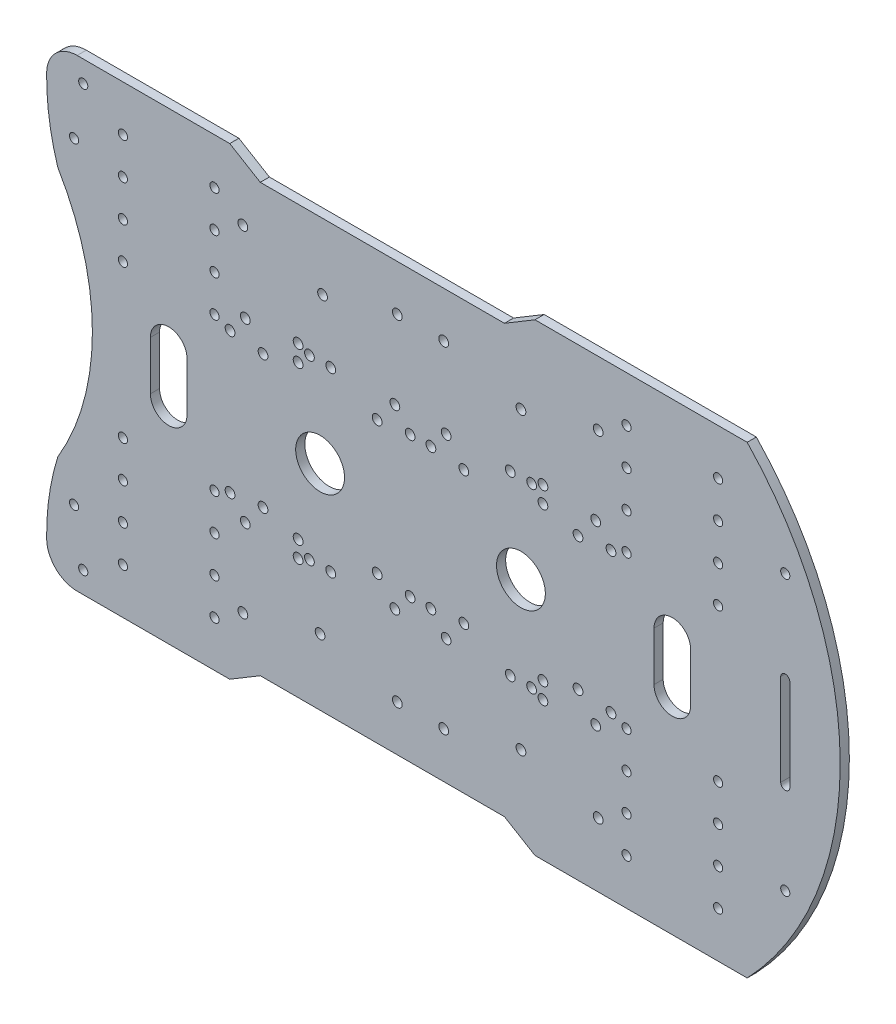
from build123d import *

# Parameters (mm, degrees)
SKETCH2_R           = 8
SKETCH2_R_2         = 1.6
SKETCH2_R_3         = 1.5
BOSS_EXTRUDE1_DEPTH = 3


with BuildPart() as part:
    # Sketch2 → Boss-Extrude1 (new body)
    with BuildSketch(Plane.XY):
        with BuildLine():
            Line((118.698481804, 213.752755906), (168.691338583, 213.752755906))
            Line((168.691338583, 213.752755906), (178.691338583, 219.752755906))
            Line((178.691338583, 219.752755906), (258.691338583, 219.752755906))
            Line((258.691338583, 219.752755906), (268.691338583, 213.752755906))
            Line((268.691338583, 213.752755906), (338.214919991, 213.752755906))
            ThreePointArc((338.214919991, 213.752755906), (368.691338583, 289.752755906), (338.214919991, 365.752755906))
            Line((338.214919991, 365.752755906), (268.691338583, 365.752755906))
            Line((268.691338583, 365.752755906), (258.691338583, 359.752755906))
            Line((258.691338583, 359.752755906), (178.691338583, 359.752755906))
            Line((178.691338583, 359.752755906), (168.691338583, 365.752755906))
            Line((168.691338583, 365.752755906), (118.698481804, 365.752755906))
            ThreePointArc((118.698481804, 365.752755906), (111.678103304, 362.874152237), (108.699502265, 355.895613048))
            ThreePointArc((108.699502265, 355.895613048), (109.530508537, 343.195810526), (112.36497097, 330.788499042))
            ThreePointArc((112.36497097, 330.788499042), (123.691338583, 289.752755906), (112.36497097, 248.717012769))
            ThreePointArc((112.36497097, 248.717012769), (109.530508537, 236.309701285), (108.699502265, 223.609898763))
            ThreePointArc((108.699502265, 223.609898763), (111.678103304, 216.631359574), (118.698481804, 213.752755906))
        make_face()
        with Locations((198.291338583, 289.752755906)):
            Circle(SKETCH2_R, mode=Mode.SUBTRACT)
        with Locations((264.091338583, 289.752755906)):
            Circle(SKETCH2_R, mode=Mode.SUBTRACT)
        with Locations((264.091338583, 338.052755906)):
            Circle(SKETCH2_R_2, mode=Mode.SUBTRACT)
        with Locations((260.591338583, 318.752755906)):
            Circle(SKETCH2_R_2, mode=Mode.SUBTRACT)
        with Locations((245.391338583, 311.552755906)):
            Circle(SKETCH2_R_2, mode=Mode.SUBTRACT)
        with Locations((238.791338583, 344.752755906)):
            Circle(SKETCH2_R_2, mode=Mode.SUBTRACT)
        with Locations((239.591338583, 318.752755906)):
            Circle(SKETCH2_R_2, mode=Mode.SUBTRACT)
        with Locations((234.591338583, 312.752755906)):
            Circle(SKETCH2_R_2, mode=Mode.SUBTRACT)
        with Locations((227.791338583, 312.752755906)):
            Circle(SKETCH2_R_2, mode=Mode.SUBTRACT)
        with Locations((216.991338583, 311.552755906)):
            Circle(SKETCH2_R_2, mode=Mode.SUBTRACT)
        with Locations((222.791338583, 318.752755906)):
            Circle(SKETCH2_R_2, mode=Mode.SUBTRACT)
        with Locations((223.591338583, 344.752755906)):
            Circle(SKETCH2_R_2, mode=Mode.SUBTRACT)
        with Locations((201.791338583, 318.752755906)):
            Circle(SKETCH2_R_2, mode=Mode.SUBTRACT)
        with Locations((194.791338583, 318.752755906)):
            Circle(SKETCH2_R_2, mode=Mode.SUBTRACT)
        with Locations((199.100829472, 338.052755906)):
            Circle(SKETCH2_R_2, mode=Mode.SUBTRACT)
        with Locations((191.091338583, 320.252755906)):
            Circle(SKETCH2_R_2, mode=Mode.SUBTRACT)
        with Locations((191.091338583, 314.852755906)):
            Circle(SKETCH2_R_2, mode=Mode.SUBTRACT)
        with Locations((179.591338583, 311.552755906)):
            Circle(SKETCH2_R_2, mode=Mode.SUBTRACT)
        with Locations((173.791338583, 318.752755906)):
            Circle(SKETCH2_R_2, mode=Mode.SUBTRACT)
        with Locations((168.791338583, 312.752755906)):
            Circle(SKETCH2_R_2, mode=Mode.SUBTRACT)
        with Locations((163.691338583, 314.752755906)):
            Circle(SKETCH2_R_3, mode=Mode.SUBTRACT)
        with Locations((163.691338583, 326.752755906)):
            Circle(SKETCH2_R_3, mode=Mode.SUBTRACT)
        with Locations((163.691338583, 338.752755906)):
            Circle(SKETCH2_R_3, mode=Mode.SUBTRACT)
        with Locations((172.991338583, 344.752755906)):
            Circle(SKETCH2_R_2, mode=Mode.SUBTRACT)
        with Locations((163.691338583, 350.752755906)):
            Circle(SKETCH2_R_3, mode=Mode.SUBTRACT)
        with Locations((133.691338583, 350.752755906)):
            Circle(SKETCH2_R_3, mode=Mode.SUBTRACT)
        with Locations((120.691338583, 358.752755906)):
            Circle(SKETCH2_R_3, mode=Mode.SUBTRACT)
        with Locations((117.691338583, 341.752755906)):
            Circle(SKETCH2_R_3, mode=Mode.SUBTRACT)
        with Locations((133.691338583, 338.752755906)):
            Circle(SKETCH2_R_3, mode=Mode.SUBTRACT)
        with Locations((133.691338583, 326.752755906)):
            Circle(SKETCH2_R_3, mode=Mode.SUBTRACT)
        with Locations((133.691338583, 314.752755906)):
            Circle(SKETCH2_R_3, mode=Mode.SUBTRACT)
        with Locations((198.291338583, 241.452755906)):
            Circle(SKETCH2_R_2, mode=Mode.SUBTRACT)
        with Locations((201.791338583, 260.752755906)):
            Circle(SKETCH2_R_2, mode=Mode.SUBTRACT)
        with Locations((216.991338583, 267.952755906)):
            Circle(SKETCH2_R_2, mode=Mode.SUBTRACT)
        with Locations((227.791338583, 266.752755906)):
            Circle(SKETCH2_R_2, mode=Mode.SUBTRACT)
        with Locations((222.791338583, 260.752755906)):
            Circle(SKETCH2_R_2, mode=Mode.SUBTRACT)
        with Locations((223.591338583, 234.752755906)):
            Circle(SKETCH2_R_2, mode=Mode.SUBTRACT)
        with Locations((238.791338583, 234.752755906)):
            Circle(SKETCH2_R_2, mode=Mode.SUBTRACT)
        with Locations((234.591338583, 266.752755906)):
            Circle(SKETCH2_R_2, mode=Mode.SUBTRACT)
        with Locations((245.391338583, 267.952755906)):
            Circle(SKETCH2_R_2, mode=Mode.SUBTRACT)
        with Locations((239.591338583, 260.752755906)):
            Circle(SKETCH2_R_2, mode=Mode.SUBTRACT)
        with Locations((264.091338583, 241.452755906)):
            Circle(SKETCH2_R_2, mode=Mode.SUBTRACT)
        with Locations((260.591338583, 260.752755906)):
            Circle(SKETCH2_R_2, mode=Mode.SUBTRACT)
        with Locations((267.591338583, 260.752755906)):
            Circle(SKETCH2_R_2, mode=Mode.SUBTRACT)
        with Locations((271.291338583, 264.652755906)):
            Circle(SKETCH2_R_2, mode=Mode.SUBTRACT)
        with Locations((271.291338583, 259.252755906)):
            Circle(SKETCH2_R_2, mode=Mode.SUBTRACT)
        with Locations((289.391338583, 234.752755906)):
            Circle(SKETCH2_R_2, mode=Mode.SUBTRACT)
        with Locations((298.691338583, 228.752755906)):
            Circle(SKETCH2_R_3, mode=Mode.SUBTRACT)
        with Locations((298.691338583, 240.752755906)):
            Circle(SKETCH2_R_3, mode=Mode.SUBTRACT)
        with Locations((288.591338583, 260.752755906)):
            Circle(SKETCH2_R_2, mode=Mode.SUBTRACT)
        with Locations((282.791338583, 267.952755906)):
            Circle(SKETCH2_R_2, mode=Mode.SUBTRACT)
        with Locations((293.591338583, 266.752755906)):
            Circle(SKETCH2_R_2, mode=Mode.SUBTRACT)
        with Locations((298.691338583, 264.752755906)):
            Circle(SKETCH2_R_3, mode=Mode.SUBTRACT)
        with Locations((298.691338583, 252.752755906)):
            Circle(SKETCH2_R_3, mode=Mode.SUBTRACT)
        with Locations((328.691338583, 228.752755906)):
            Circle(SKETCH2_R_3, mode=Mode.SUBTRACT)
        with Locations((328.691338583, 240.752755906)):
            Circle(SKETCH2_R_3, mode=Mode.SUBTRACT)
        with Locations((328.691338583, 252.752755906)):
            Circle(SKETCH2_R_3, mode=Mode.SUBTRACT)
        with Locations((328.691338583, 264.752755906)):
            Circle(SKETCH2_R_3, mode=Mode.SUBTRACT)
        with Locations((350.691338583, 244.752755906)):
            Circle(SKETCH2_R_3, mode=Mode.SUBTRACT)
        with Locations((350.691338583, 334.752755906)):
            Circle(SKETCH2_R_3, mode=Mode.SUBTRACT)
        with Locations((328.691338583, 350.752755906)):
            Circle(SKETCH2_R_3, mode=Mode.SUBTRACT)
        with Locations((328.691338583, 338.752755906)):
            Circle(SKETCH2_R_3, mode=Mode.SUBTRACT)
        with Locations((328.691338583, 326.752755906)):
            Circle(SKETCH2_R_3, mode=Mode.SUBTRACT)
        with Locations((328.691338583, 314.752755906)):
            Circle(SKETCH2_R_3, mode=Mode.SUBTRACT)
        with Locations((282.791338583, 311.552755906)):
            Circle(SKETCH2_R_2, mode=Mode.SUBTRACT)
        with Locations((288.591338583, 318.752755906)):
            Circle(SKETCH2_R_2, mode=Mode.SUBTRACT)
        with Locations((293.591338583, 312.752755906)):
            Circle(SKETCH2_R_2, mode=Mode.SUBTRACT)
        with Locations((298.691338583, 314.752755906)):
            Circle(SKETCH2_R_3, mode=Mode.SUBTRACT)
        with Locations((298.691338583, 326.752755906)):
            Circle(SKETCH2_R_3, mode=Mode.SUBTRACT)
        with Locations((298.691338583, 338.752755906)):
            Circle(SKETCH2_R_3, mode=Mode.SUBTRACT)
        with Locations((298.691338583, 350.752755906)):
            Circle(SKETCH2_R_3, mode=Mode.SUBTRACT)
        with Locations((289.391338583, 344.752755906)):
            Circle(SKETCH2_R_2, mode=Mode.SUBTRACT)
        with Locations((271.291338583, 320.252755906)):
            Circle(SKETCH2_R_2, mode=Mode.SUBTRACT)
        with Locations((271.291338583, 314.852755906)):
            Circle(SKETCH2_R_2, mode=Mode.SUBTRACT)
        with Locations((267.591338583, 318.752755906)):
            Circle(SKETCH2_R_2, mode=Mode.SUBTRACT)
        with Locations((120.691338583, 220.752755906)):
            Circle(SKETCH2_R_3, mode=Mode.SUBTRACT)
        with Locations((117.691338583, 237.752755906)):
            Circle(SKETCH2_R_3, mode=Mode.SUBTRACT)
        with Locations((133.691338583, 264.752755906)):
            Circle(SKETCH2_R_3, mode=Mode.SUBTRACT)
        with Locations((133.691338583, 252.752755906)):
            Circle(SKETCH2_R_3, mode=Mode.SUBTRACT)
        with Locations((133.691338583, 240.752755906)):
            Circle(SKETCH2_R_3, mode=Mode.SUBTRACT)
        with Locations((133.691338583, 228.752755906)):
            Circle(SKETCH2_R_3, mode=Mode.SUBTRACT)
        with Locations((163.691338583, 228.752755906)):
            Circle(SKETCH2_R_3, mode=Mode.SUBTRACT)
        with Locations((163.691338583, 240.752755906)):
            Circle(SKETCH2_R_3, mode=Mode.SUBTRACT)
        with Locations((172.991338583, 234.752755906)):
            Circle(SKETCH2_R_2, mode=Mode.SUBTRACT)
        with Locations((163.691338583, 252.752755906)):
            Circle(SKETCH2_R_3, mode=Mode.SUBTRACT)
        with Locations((163.691338583, 264.752755906)):
            Circle(SKETCH2_R_3, mode=Mode.SUBTRACT)
        with Locations((168.791338583, 266.752755906)):
            Circle(SKETCH2_R_2, mode=Mode.SUBTRACT)
        with Locations((173.791338583, 260.752755906)):
            Circle(SKETCH2_R_2, mode=Mode.SUBTRACT)
        with Locations((179.591338583, 267.952755906)):
            Circle(SKETCH2_R_2, mode=Mode.SUBTRACT)
        with Locations((191.091338583, 264.652755906)):
            Circle(SKETCH2_R_2, mode=Mode.SUBTRACT)
        with Locations((194.791338583, 260.752755906)):
            Circle(SKETCH2_R_2, mode=Mode.SUBTRACT)
        with Locations((191.091338583, 259.252755906)):
            Circle(SKETCH2_R_2, mode=Mode.SUBTRACT)
        with BuildLine():
            Line((142.691338583, 297.752755906), (142.691338583, 281.752755906))
            ThreePointArc((142.691338583, 281.752755906), (148.691338583, 275.752755906), (154.691338583, 281.752755906))
            Line((154.691338583, 281.752755906), (154.691338583, 297.752755906))
            ThreePointArc((154.691338583, 297.752755906), (148.691338583, 303.752755906), (142.691338583, 297.752755906))
        make_face(mode=Mode.SUBTRACT)
        with BuildLine():
            Line((307.691338583, 297.752755906), (307.691338583, 281.752755906))
            ThreePointArc((307.691338583, 281.752755906), (313.691338583, 275.752755906), (319.691338583, 281.752755906))
            Line((319.691338583, 281.752755906), (319.691338583, 297.752755906))
            ThreePointArc((319.691338583, 297.752755906), (313.691338583, 303.752755906), (307.691338583, 297.752755906))
        make_face(mode=Mode.SUBTRACT)
        with BuildLine():
            Line((349.191338583, 304.752755906), (349.191338583, 274.752755906))
            ThreePointArc((349.191338583, 274.752755906), (350.691338583, 273.252755906), (352.191338583, 274.752755906))
            Line((352.191338583, 274.752755906), (352.191338583, 304.752755906))
            ThreePointArc((352.191338583, 304.752755906), (350.691338583, 306.252755906), (349.191338583, 304.752755906))
        make_face(mode=Mode.SUBTRACT)
    extrude(amount=BOSS_EXTRUDE1_DEPTH)


solid = part.part
